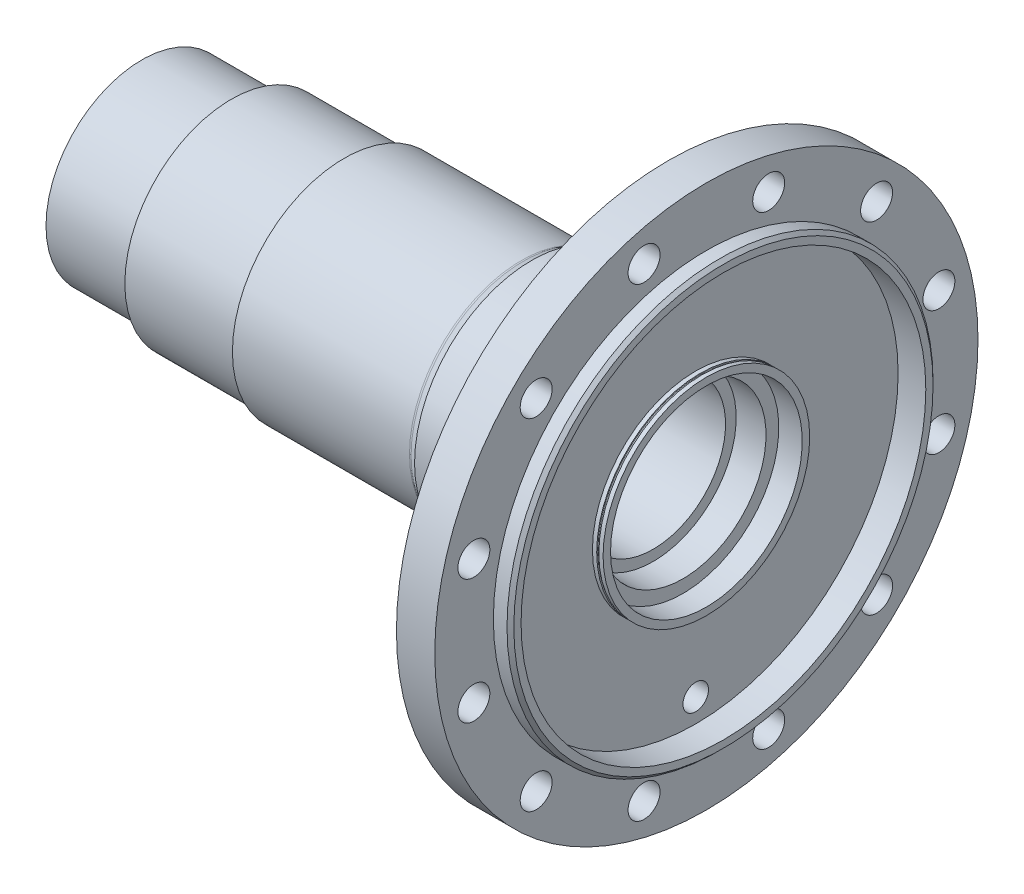
from build123d import *

# Parameters (mm, degrees)
SKETCH_3_W           = 2
SKETCH_3_H           = 46.5
SKETCH_5_W           = 2
SKETCH_5_H           = 46.5
SKETCH_6_R           = 7.5
CUT_EXTRUDE_1_DEPTH  = 328.171973127
SKETCH_7_R           = 7.5
CUT_EXTRUDE_2_DEPTH  = 328.171973127
SKETCH_8_R           = 7.5
CUT_EXTRUDE_3_DEPTH  = 328.171973127
SKETCH_9_R           = 7.5
CUT_EXTRUDE_4_DEPTH  = 328.171973127
SKETCH_10_R          = 7.5
CUT_EXTRUDE_5_DEPTH  = 328.171973127
SKETCH_11_R          = 7.5
CUT_EXTRUDE_6_DEPTH  = 328.171973127
SKETCH_12_R          = 7.5
CUT_EXTRUDE_7_DEPTH  = 328.171973127
SKETCH_13_R          = 7.5
CUT_EXTRUDE_8_DEPTH  = 328.171973127
SKETCH_14_R          = 7.5
CUT_EXTRUDE_9_DEPTH  = 328.171973127
SKETCH_15_R          = 7.5
CUT_EXTRUDE_10_DEPTH = 328.171973127
SKETCH_16_R          = 7.5
CUT_EXTRUDE_11_DEPTH = 328.171973127
SKETCH_17_R          = 7.5
CUT_EXTRUDE_12_DEPTH = 328.171973127
SKETCH_18_R          = 6
CUT_EXTRUDE_13_DEPTH = 328.171973127


with BuildPart() as part:
    # Эскиз1 → Повернуть1 (revolve)
    with BuildSketch(Plane.XY, mode=Mode.PRIVATE) as revolve_1_sk:
        with BuildLine():
            Line((0, 0), (273, 0))
            Line((273, 0), (273, 98.4))
            Line((273, 98.4), (271.4, 100))
            Line((271.4, 100), (265, 100))
            Line((265, 100), (265, 127.5))
            Line((265, 127.5), (247, 127.5))
            Line((247, 127.5), (247, 100))
            Line((247, 100), (241, 100))
            Line((241, 100), (241, 68.328427125))
            ThreePointArc((241, 68.328427125), (240.847759065, 67.56306026), (240.414213562, 66.914213562))
            Line((240.414213562, 66.914213562), (239, 65.5))
            Line((239, 65.5), (239, 64.5))
            ThreePointArc((239, 64.5), (238.414213562, 63.085786438), (237, 62.5))
            Line((237, 62.5), (218, 62.5))
            Line((218, 62.5), (215, 60.767949192))
            Line((215, 60.767949192), (215, 57))
            ThreePointArc((215, 57), (214.414213562, 55.585786438), (213, 55))
            Line((213, 55), (183, 55))
            Line((183, 55), (179.133974596, 52.767949192))
            ThreePointArc((179.133974596, 52.767949192), (178.651612686, 52.568148347), (178.133974596, 52.5))
            Line((178.133974596, 52.5), (95, 52.5))
            Line((95, 52.5), (95, 50))
            Line((95, 50), (42, 50))
            Line((42, 50), (42, 45))
            Line((42, 45), (0, 45))
            Line((0, 45), (0, 0))
        make_face()
    revolve(revolve_1_sk.sketch.rotate(Axis((0, 0, 0), (1, 0, 0)), 90), axis=Axis((0, 0, 0), (1, 0, 0)))

    # Эскиз2 → Вырез-Повернуть1 (revolve, cut)
    with BuildSketch(Plane.XY, mode=Mode.PRIVATE) as cut_revolve_1_sk:
        Polygon((0, 0), (273, 0), (273, 95), (265, 95), (265, 45), (254, 45), (254, 39), (240, 39), (240, 34), (203.5, 34), (203.5, 31), (0, 31), align=None)
    revolve(cut_revolve_1_sk.sketch.rotate(Axis((0, 0, 0), (1, 0, 0)), 90), axis=Axis((0, 0, 0), (1, 0, 0)), mode=Mode.SUBTRACT)

    # Эскиз3 → Rear_recess_left (revolve, cut)
    with BuildSketch(Plane.XY, mode=Mode.PRIVATE) as rear_recess_left_sk:
        with Locations((261, 71.75)):
            Rectangle(SKETCH_3_W, SKETCH_3_H)
    revolve(rear_recess_left_sk.sketch.rotate(Axis((0, 0, 0), (1, 0, 0)), 90), axis=Axis((0, 0, 0), (1, 0, 0)), mode=Mode.SUBTRACT)

    # Эскиз4 → Collar_groove_nominal (revolve, cut)
    with BuildSketch(Plane.XY, mode=Mode.PRIVATE) as collar_groove_nominal_sk:
        with BuildLine():
            Line((263, 48), (263, 95))
            Line((263, 95), (262, 95))
            Line((262, 95), (262, 48))
            ThreePointArc((262, 48), (262.146446609, 47.646446609), (262.5, 47.5))
            ThreePointArc((262.5, 47.5), (262.853553391, 47.646446609), (263, 48))
        make_face()
    revolve(collar_groove_nominal_sk.sketch.rotate(Axis((0, 0, 0), (1, 0, 0)), 90), axis=Axis((0, 0, 0), (1, 0, 0)), mode=Mode.SUBTRACT)

    # Эскиз5 → Rear_recess_lip (revolve, cut)
    with BuildSketch(Plane.XY, mode=Mode.PRIVATE) as rear_recess_lip_sk:
        with Locations((264, 71.75)):
            Rectangle(SKETCH_5_W, SKETCH_5_H)
    revolve(rear_recess_lip_sk.sketch.rotate(Axis((0, 0, 0), (1, 0, 0)), 90), axis=Axis((0, 0, 0), (1, 0, 0)), mode=Mode.SUBTRACT)

    # Эскиз6 → Вырез-Вытянуть1 (cut, through all)
    with BuildSketch(Plane(origin=(0, 0, 0), x_dir=(0, 0, -1), z_dir=(1, 0, 0))):
        with Locations(Location((109.149618371, 29.246552097, 0), (0, 0, 180))):
            Circle(SKETCH_6_R)
    extrude(amount=CUT_EXTRUDE_1_DEPTH, mode=Mode.SUBTRACT)

    # Эскиз7 → Вырез-Вытянуть2 (cut, through all)
    with BuildSketch(Plane(origin=(0, 0, 0), x_dir=(0, 0, -1), z_dir=(1, 0, 0))):
        with Locations(Location((79.903066274, 79.903066274, 0), (0, 0, 180))):
            Circle(SKETCH_7_R)
    extrude(amount=CUT_EXTRUDE_2_DEPTH, mode=Mode.SUBTRACT)

    # Эскиз8 → Вырез-Вытянуть3 (cut, through all)
    with BuildSketch(Plane(origin=(0, 0, 0), x_dir=(0, 0, -1), z_dir=(1, 0, 0))):
        with Locations(Location((29.246552097, 109.149618371, 0), (0, 0, 180))):
            Circle(SKETCH_8_R)
    extrude(amount=CUT_EXTRUDE_3_DEPTH, mode=Mode.SUBTRACT)

    # Эскиз9 → Вырез-Вытянуть4 (cut, through all)
    with BuildSketch(Plane(origin=(0, 0, 0), x_dir=(0, 0, -1), z_dir=(1, 0, 0))):
        with Locations(Location((-29.246552097, 109.149618371, 0), (0, 0, 180))):
            Circle(SKETCH_9_R)
    extrude(amount=CUT_EXTRUDE_4_DEPTH, mode=Mode.SUBTRACT)

    # Эскиз10 → Вырез-Вытянуть5 (cut, through all)
    with BuildSketch(Plane(origin=(0, 0, 0), x_dir=(0, 0, -1), z_dir=(1, 0, 0))):
        with Locations(Location((-79.903066274, 79.903066274, 0), (0, 0, 180))):
            Circle(SKETCH_10_R)
    extrude(amount=CUT_EXTRUDE_5_DEPTH, mode=Mode.SUBTRACT)

    # Эскиз11 → Вырез-Вытянуть6 (cut, through all)
    with BuildSketch(Plane(origin=(0, 0, 0), x_dir=(0, 0, -1), z_dir=(1, 0, 0))):
        with Locations(Location((-109.149618371, 29.246552097, 0), (0, 0, 180))):
            Circle(SKETCH_11_R)
    extrude(amount=CUT_EXTRUDE_6_DEPTH, mode=Mode.SUBTRACT)

    # Эскиз12 → Вырез-Вытянуть7 (cut, through all)
    with BuildSketch(Plane(origin=(0, 0, 0), x_dir=(0, 0, -1), z_dir=(1, 0, 0))):
        with Locations(Location((-109.149618371, -29.246552097, 0), (0, 0, 180))):
            Circle(SKETCH_12_R)
    extrude(amount=CUT_EXTRUDE_7_DEPTH, mode=Mode.SUBTRACT)

    # Эскиз13 → Вырез-Вытянуть8 (cut, through all)
    with BuildSketch(Plane(origin=(0, 0, 0), x_dir=(0, 0, -1), z_dir=(1, 0, 0))):
        with Locations(Location((-79.903066274, -79.903066274, 0), (0, 0, 180))):
            Circle(SKETCH_13_R)
    extrude(amount=CUT_EXTRUDE_8_DEPTH, mode=Mode.SUBTRACT)

    # Эскиз14 → Вырез-Вытянуть9 (cut, through all)
    with BuildSketch(Plane(origin=(0, 0, 0), x_dir=(0, 0, -1), z_dir=(1, 0, 0))):
        with Locations(Location((-29.246552097, -109.149618371, 0), (0, 0, 180))):
            Circle(SKETCH_14_R)
    extrude(amount=CUT_EXTRUDE_9_DEPTH, mode=Mode.SUBTRACT)

    # Эскиз15 → Вырез-Вытянуть10 (cut, through all)
    with BuildSketch(Plane(origin=(0, 0, 0), x_dir=(0, 0, -1), z_dir=(1, 0, 0))):
        with Locations(Location((29.246552097, -109.149618371, 0), (0, 0, 180))):
            Circle(SKETCH_15_R)
    extrude(amount=CUT_EXTRUDE_10_DEPTH, mode=Mode.SUBTRACT)

    # Эскиз16 → Вырез-Вытянуть11 (cut, through all)
    with BuildSketch(Plane(origin=(0, 0, 0), x_dir=(0, 0, -1), z_dir=(1, 0, 0))):
        with Locations(Location((79.903066274, -79.903066274, 0), (0, 0, 180))):
            Circle(SKETCH_16_R)
    extrude(amount=CUT_EXTRUDE_11_DEPTH, mode=Mode.SUBTRACT)

    # Эскиз17 → Вырез-Вытянуть12 (cut, through all)
    with BuildSketch(Plane(origin=(0, 0, 0), x_dir=(0, 0, -1), z_dir=(1, 0, 0))):
        with Locations(Location((109.149618371, -29.246552097, 0), (0, 0, 180))):
            Circle(SKETCH_17_R)
    extrude(amount=CUT_EXTRUDE_12_DEPTH, mode=Mode.SUBTRACT)

    # Эскиз18 → Вырез-Вытянуть13 (cut, through all)
    with BuildSketch(Plane(origin=(0, 0, 0), x_dir=(0, 0, -1), z_dir=(1, 0, 0))):
        with Locations((0, -84)):
            Circle(SKETCH_18_R)
    extrude(amount=CUT_EXTRUDE_13_DEPTH, mode=Mode.SUBTRACT)


solid = part.part
